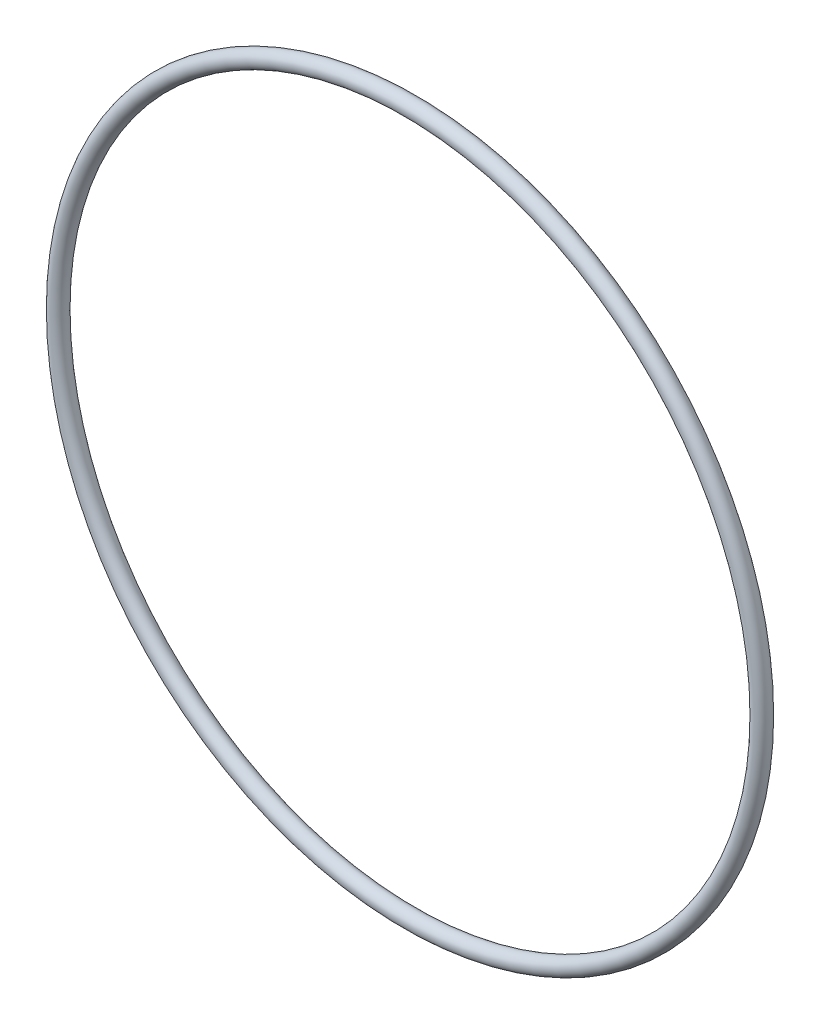
from build123d import *

# Parameters (mm, degrees)
SKETCH2_R = 1.31


with BuildPart() as part:
    # Sweep1: sweep along a path in Sketch1
    with BuildLine(Plane.XY) as sweep1_path:
        CenterArc((0, 0), 55, 0, 360)
    # Sketch2 → Sweep1 (sweep)
    with BuildSketch(Plane(origin=(0, 0, 0), x_dir=(1, 0, 0), z_dir=(0, 1, 0))):
        with Locations((-55, 0)):
            Circle(SKETCH2_R)
    sweep(path=sweep1_path.line)


solid = part.part
